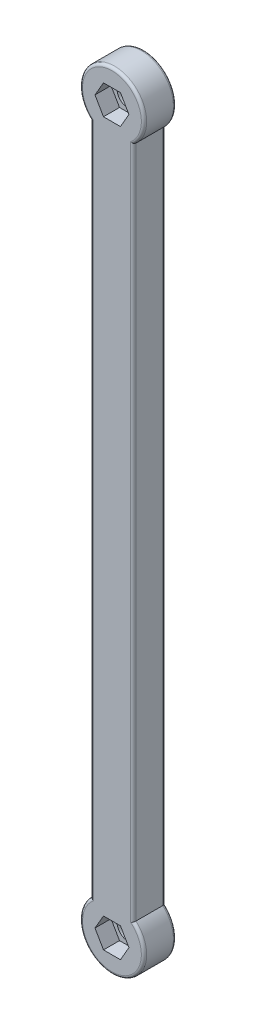
from build123d import *

# Parameters (mm, degrees)
SKETCH_1_R          = 2.05
EXTRUDE_1_DEPTH     = 3
CUT_EXTRUDE_1_DEPTH = 3
FILLET_1_R          = 0.5


with BuildPart() as part:
    # 草图1 → 凸台-拉伸1 (new, symmetric)
    with BuildSketch(Plane.XY):
        with BuildLine():
            ThreePointArc((4, 130.527864045), (0, 141), (-4, 130.527864045))
            Line((-4, 130.527864045), (-4, 4.472135955))
            ThreePointArc((-4, 4.472135955), (0, -6), (4, 4.472135955))
            Line((4, 4.472135955), (4, 130.527864045))
        make_face()
        Circle(SKETCH_1_R, mode=Mode.SUBTRACT)
        with Locations((0, 135)):
            Circle(SKETCH_1_R, mode=Mode.SUBTRACT)
    extrude(amount=EXTRUDE_1_DEPTH, both=True)

    # 草图2 → 切除-拉伸1 (cut)
    with BuildSketch(Plane.XY.offset(3)):
        Polygon((1.58771324, -2.75), (3.175426481, 0), (1.58771324, 2.75), (-1.58771324, 2.75), (-3.175426481, 0), (-1.58771324, -2.75), align=None)
        Polygon((1.58771324, 132.25), (3.175426481, 135), (1.58771324, 137.75), (-1.58771324, 137.75), (-3.175426481, 135), (-1.58771324, 132.25), align=None)
    extrude(amount=-CUT_EXTRUDE_1_DEPTH, mode=Mode.SUBTRACT)

    # 圆角1
    fillet_1_edges = [part.edges().sort_by_distance(p)[0] for p in [
        (0, -6, 3),
        (0, -6, -3),
        (0, 141, 3),
        (0, 141, -3),
        (4, 67.5, -3),
        (4, 67.5, 3),
        (-4, 67.5, 3),
        (-4, 67.5, -3),
    ]]
    fillet(fillet_1_edges, radius=FILLET_1_R)


solid = part.part
